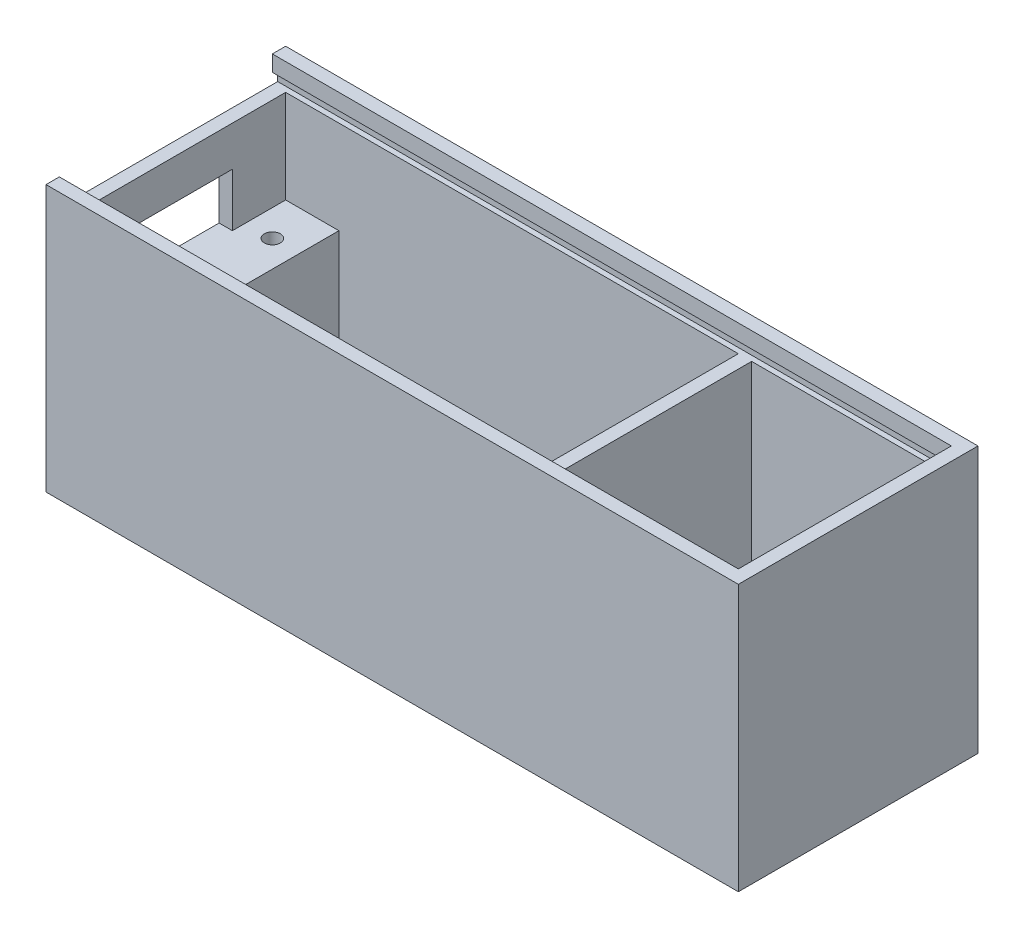
from build123d import *

# Parameters (mm, degrees)
SKETCH1_W           = 130
SKETCH1_H           = 45
BOSS_EXTRUDE1_DEPTH = 50
SHELL1_T            = -2.5
SKETCH2_W           = 10
SKETCH2_H           = 40
BOSS_EXTRUDE2_DEPTH = 30
SKETCH5_W           = 2.5
SKETCH5_H           = 40
BOSS_EXTRUDE3_DEPTH = 47.5
SKETCH6_W           = 10
SKETCH6_H           = 40
BOSS_EXTRUDE4_DEPTH = 20
SKETCH7_W           = 10
SKETCH7_H           = 40
BOSS_EXTRUDE5_DEPTH = 25
SKETCH9_W           = 20
SKETCH9_H           = 10
CUT_EXTRUDE1_DEPTH  = 2.5
SKETCH11_W          = 15
SKETCH11_H          = 15
CUT_EXTRUDE2_DEPTH  = 12.5
SKETCH12_W          = 40
SKETCH12_H          = 5
CUT_EXTRUDE3_DEPTH  = 2.5
SKETCH20_R          = 1.5
CUT_EXTRUDE5_DEPTH  = 32.5
SKETCH21_R          = 1.5
CUT_EXTRUDE6_DEPTH  = 22.5
SKETCH22_R          = 1.5
CUT_EXTRUDE7_DEPTH  = 27.5
SKETCH24_R          = 3
CUT_EXTRUDE8_DEPTH  = 5
SKETCH25_W          = 40
SKETCH25_H          = 5
CUT_EXTRUDE9_DEPTH  = 2.5
SKETCH26_W          = 127.5
SKETCH26_H          = 2
CUT_EXTRUDE10_DEPTH = 1
SKETCH27_W          = 127.5
SKETCH27_H          = 2
CUT_EXTRUDE11_DEPTH = 1


with BuildPart() as part:
    # Sketch1 → Boss-Extrude1 (new body)
    with BuildSketch(Plane(origin=(0, 0, 0), x_dir=(1, 0, 0), z_dir=(0, 1, 0))):
        with Locations((6.071202057, 3.880136761)):
            Rectangle(SKETCH1_W, SKETCH1_H)
    extrude(amount=BOSS_EXTRUDE1_DEPTH)

    # Shell1
    shell1_openings = [part.faces().sort_by_distance(p)[0] for p in [
        (6.071202057, 50, -3.880136761),
    ]]
    offset(amount=SHELL1_T, openings=shell1_openings, kind=Kind.INTERSECTION)

    # Sketch2 → Boss-Extrude2 (add)
    with BuildSketch(Plane(origin=(0, 2.5, 0), x_dir=(1, 0, 0), z_dir=(0, 1, 0))):
        with Locations((63.571202057, 3.880136761)):
            Rectangle(SKETCH2_W, SKETCH2_H)
    extrude(amount=BOSS_EXTRUDE2_DEPTH)

    # Sketch5 → Boss-Extrude3 (add)
    with BuildSketch(Plane(origin=(0, 2.5, 0), x_dir=(1, 0, 0), z_dir=(0, 1, 0))):
        with Locations((29.821202057, 3.880136761)):
            Rectangle(SKETCH5_W, SKETCH5_H)
    extrude(amount=BOSS_EXTRUDE3_DEPTH)

    # Sketch6 → Boss-Extrude4 (add)
    with BuildSketch(Plane(origin=(0, 2.5, 0), x_dir=(1, 0, 0), z_dir=(0, 1, 0))):
        with Locations((23.571202057, 3.880136761)):
            Rectangle(SKETCH6_W, SKETCH6_H)
    extrude(amount=BOSS_EXTRUDE4_DEPTH)

    # Sketch7 → Boss-Extrude5 (add)
    with BuildSketch(Plane(origin=(0, 2.5, 0), x_dir=(1, 0, 0), z_dir=(0, 1, 0))):
        with Locations((-51.428797943, 3.880136761)):
            Rectangle(SKETCH7_W, SKETCH7_H)
    extrude(amount=BOSS_EXTRUDE5_DEPTH)

    # Sketch9 → Cut-Extrude1 (cut)
    with BuildSketch(Plane(origin=(-56.428797943, 0, 0), x_dir=(0, 0, -1), z_dir=(1, 0, 0))):
        with Locations((3.880136761, 32.5)):
            Rectangle(SKETCH9_W, SKETCH9_H)
    extrude(amount=-CUT_EXTRUDE1_DEPTH, mode=Mode.SUBTRACT)

    # Sketch11 → Cut-Extrude2 (cut)
    with BuildSketch(Plane.ZY.offset(-18.571202057)):
        with Locations((-3.880136761, 10)):
            Rectangle(SKETCH11_W, SKETCH11_H)
    extrude(amount=-CUT_EXTRUDE2_DEPTH, mode=Mode.SUBTRACT)

    # Sketch12 → Cut-Extrude3 (cut)
    with BuildSketch(Plane(origin=(-56.428797943, 0, 0), x_dir=(0, 0, -1), z_dir=(1, 0, 0))):
        with Locations((3.880136761, 47.5)):
            Rectangle(SKETCH12_W, SKETCH12_H)
    extrude(amount=-CUT_EXTRUDE3_DEPTH, mode=Mode.SUBTRACT)

    # Sketch20 → Cut-Extrude5 (cut)
    with BuildSketch(Plane(origin=(0, 32.5, 0), x_dir=(1, 0, 0), z_dir=(0, 1, 0))):
        with Locations(Location((63.571202057, -3.619863239, 0), (0, 0, 270))):
            Circle(SKETCH20_R)
        with Locations(Location((63.571202057, 11.380136761, 0), (0, 0, 270))):
            Circle(SKETCH20_R)
    extrude(amount=-CUT_EXTRUDE5_DEPTH, mode=Mode.SUBTRACT)

    # Sketch21 → Cut-Extrude6 (cut)
    with BuildSketch(Plane(origin=(0, 22.5, 0), x_dir=(1, 0, 0), z_dir=(0, 1, 0))):
        with Locations(Location((23.571202057, -8.619863239, 0), (0, 0, 270))):
            Circle(SKETCH21_R)
        with Locations(Location((23.571202057, 16.380136761, 0), (0, 0, 270))):
            Circle(SKETCH21_R)
    extrude(amount=-CUT_EXTRUDE6_DEPTH, mode=Mode.SUBTRACT)

    # Sketch22 → Cut-Extrude7 (cut)
    with BuildSketch(Plane(origin=(0, 27.5, 0), x_dir=(1, 0, 0), z_dir=(0, 1, 0))):
        with Locations(Location((-51.428797943, -8.619863239, 0), (0, 0, 270))):
            Circle(SKETCH22_R)
        with Locations(Location((-51.428797943, 16.380136761, 0), (0, 0, 270))):
            Circle(SKETCH22_R)
    extrude(amount=-CUT_EXTRUDE7_DEPTH, mode=Mode.SUBTRACT)

    # Sketch24 → Cut-Extrude8 (cut)
    with BuildSketch(Plane.XZ):
        with Locations(Location((-51.428797943, 8.619863239, 0), (0, 0, 270))):
            Circle(SKETCH24_R)
        with Locations(Location((-51.428797943, -16.380136761, 0), (0, 0, 270))):
            Circle(SKETCH24_R)
        with Locations(Location((23.571202057, 8.619863239, 0), (0, 0, 270))):
            Circle(SKETCH24_R)
        with Locations(Location((23.571202057, -16.380136761, 0), (0, 0, 270))):
            Circle(SKETCH24_R)
        with Locations(Location((63.571202057, 3.619863239, 0), (0, 0, 270))):
            Circle(SKETCH24_R)
        with Locations(Location((63.571202057, -11.380136761, 0), (0, 0, 270))):
            Circle(SKETCH24_R)
    extrude(amount=-CUT_EXTRUDE8_DEPTH, mode=Mode.SUBTRACT)

    # Sketch25 → Cut-Extrude9 (cut)
    with BuildSketch(Plane.ZY.offset(-28.571202057)):
        with Locations((-3.880136761, 47.5)):
            Rectangle(SKETCH25_W, SKETCH25_H)
    extrude(amount=-CUT_EXTRUDE9_DEPTH, mode=Mode.SUBTRACT)

    # Sketch26 → Cut-Extrude10 (cut)
    with BuildSketch(Plane(origin=(0, 0, 16.119863239), x_dir=(-1, 0, 0), z_dir=(0, 0, -1))):
        with Locations((-4.821202057, 46)):
            Rectangle(SKETCH26_W, SKETCH26_H)
    extrude(amount=-CUT_EXTRUDE10_DEPTH, mode=Mode.SUBTRACT)

    # Sketch27 → Cut-Extrude11 (cut)
    with BuildSketch(Plane.XY.offset(-23.880136761)):
        with Locations((4.821202057, 46)):
            Rectangle(SKETCH27_W, SKETCH27_H)
    extrude(amount=-CUT_EXTRUDE11_DEPTH, mode=Mode.SUBTRACT)


solid = part.part
